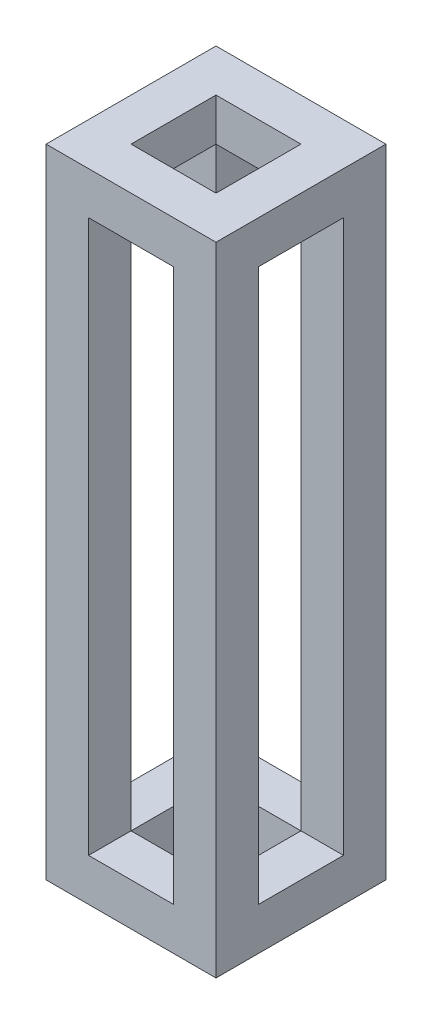
from build123d import *

# Parameters (mm, degrees)
SKETCH1_W           = 80
SKETCH1_H           = 80
SKETCH1_W_2         = 40
SKETCH1_H_2         = 40
BOSS_EXTRUDE1_DEPTH = 20
SKETCH2_W           = 20
SKETCH2_H           = 20
BOSS_EXTRUDE2_DEPTH = 300
SKETCH4_W           = 80
SKETCH4_H           = 80
SKETCH4_W_2         = 40
SKETCH4_H_2         = 40
BOSS_EXTRUDE3_DEPTH = 20


with BuildPart() as part:
    # Sketch1 → Boss-Extrude1 (new body)
    with BuildSketch(Plane(origin=(0, 0, 0), x_dir=(1, 0, 0), z_dir=(0, 1, 0))):
        Rectangle(SKETCH1_W, SKETCH1_H)
        Rectangle(SKETCH1_W_2, SKETCH1_H_2, mode=Mode.SUBTRACT)
    extrude(amount=BOSS_EXTRUDE1_DEPTH)

    # Sketch2 → Boss-Extrude2 (add)
    with BuildSketch(Plane(origin=(0, 300, 0), x_dir=(1, 0, 0), z_dir=(0, 1, 0))):
        with Locations((-30, 30)):
            Rectangle(SKETCH2_W, SKETCH2_H)
        with Locations((30, 30)):
            Rectangle(SKETCH2_W, SKETCH2_H)
        with Locations((30, -30)):
            Rectangle(SKETCH2_W, SKETCH2_H)
        with Locations((-30, -30)):
            Rectangle(SKETCH2_W, SKETCH2_H)
    extrude(amount=-BOSS_EXTRUDE2_DEPTH)

    # Sketch4 → Boss-Extrude3 (add)
    with BuildSketch(Plane(origin=(0, 300, 0), x_dir=(1, 0, 0), z_dir=(0, 1, 0))):
        Rectangle(SKETCH4_W, SKETCH4_H)
        Rectangle(SKETCH4_W_2, SKETCH4_H_2, mode=Mode.SUBTRACT)
    extrude(amount=-BOSS_EXTRUDE3_DEPTH)


solid = part.part
